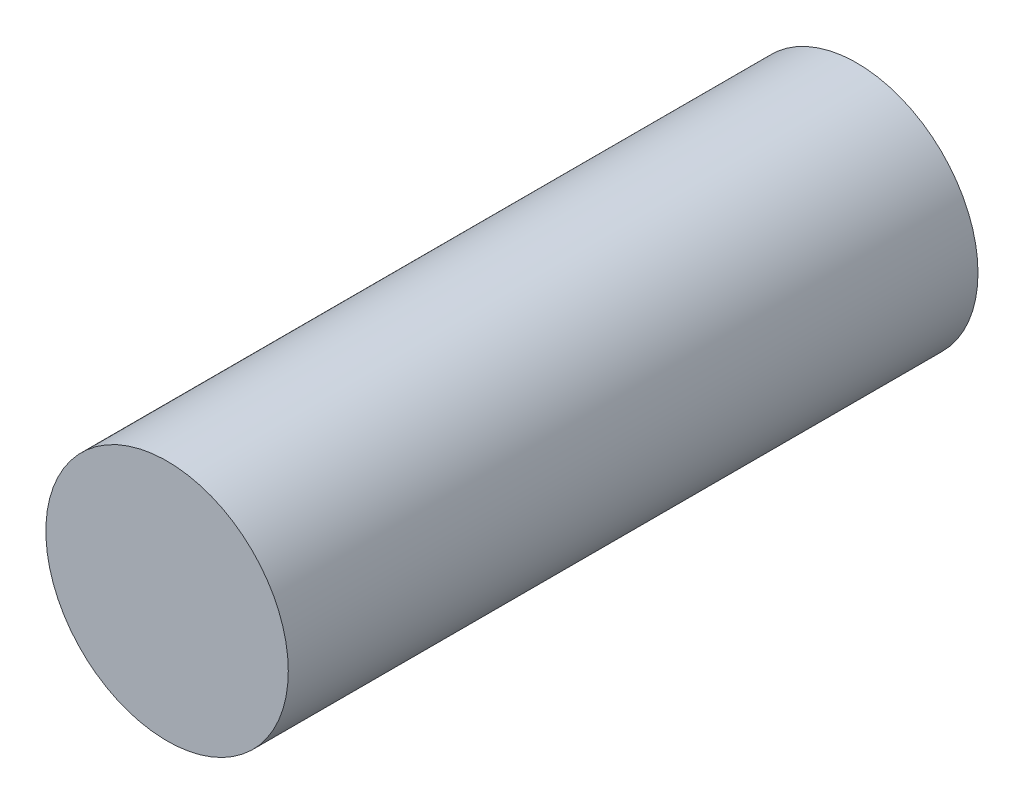
from build123d import *

# Parameters (mm, degrees)
SKETCH1_R           = 12.500000019
BOSS_EXTRUDE1_DEPTH = 71.12


with BuildPart() as part:
    # Sketch1 → Boss-Extrude1 (new body)
    with BuildSketch(Plane.XY):
        Circle(SKETCH1_R)
    extrude(amount=BOSS_EXTRUDE1_DEPTH)


solid = part.part
